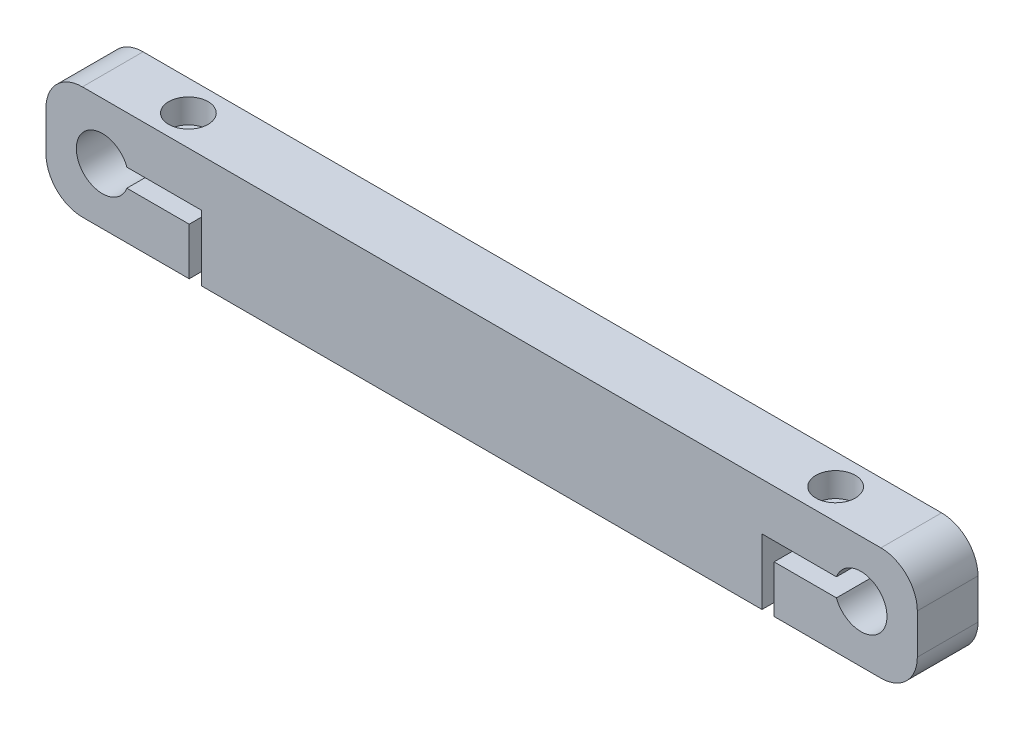
from build123d import *

# Parameters (mm, degrees)
SALIENTE_EXTRUIR1_DEPTH = 10
CROQUIS2_R              = 1.9
CORTAR_EXTRUIR1_DEPTH   = 25
CROQUIS5_R              = 3.25
CORTAR_EXTRUIR3_DEPTH   = 4
CORTAR_EXTRUIR4_DEPTH   = 4.25


with BuildPart() as part:
    # Croquis1 → Saliente-Extruir1 (new body)
    with BuildSketch(Plane.XY):
        with BuildLine():
            Line((65.8, 9.3), (-65.8, 9.3))
            ThreePointArc((-65.8, 9.3), (-70.042640687, 7.542640687), (-71.8, 3.3))
            Line((-71.8, 3.3), (-71.8, -3.3))
            ThreePointArc((-71.8, -3.3), (-70.042640687, -7.542640687), (-65.8, -9.3))
            Line((-65.8, -9.3), (-48.2, -9.3))
            Line((-48.2, -9.3), (-48.2, -1.5))
            Line((-48.2, -1.5), (-58.470111664, -1.5))
            ThreePointArc((-58.470111664, -1.5), (-66.8, 0), (-58.470111664, 1.5))
            Line((-58.470111664, 1.5), (-46.2, 1.5))
            Line((-46.2, 1.5), (-46.2, -9.3))
            Line((-46.2, -9.3), (46.2, -9.3))
            Line((46.2, -9.3), (46.2, 1.5))
            Line((46.2, 1.5), (58.470111664, 1.5))
            ThreePointArc((58.470111664, 1.5), (63.262063041, 4.231933355), (66.8, 0))
            ThreePointArc((66.8, 0), (63.262063041, -4.231933355), (58.470111664, -1.5))
            Line((58.470111664, -1.5), (48.2, -1.5))
            Line((48.2, -1.5), (48.2, -9.3))
            Line((48.2, -9.3), (65.8, -9.3))
            ThreePointArc((65.8, -9.3), (70.042640687, -7.542640687), (71.8, -3.3))
            Line((71.8, -3.3), (71.8, 3.3))
            ThreePointArc((71.8, 3.3), (70.042640687, 7.542640687), (65.8, 9.3))
        make_face()
    extrude(amount=SALIENTE_EXTRUIR1_DEPTH)

    # Croquis2 → Cortar-Extruir1 (cut, symmetric)
    with BuildSketch(Plane.XZ.offset(-1.5)):
        with Locations(Location((-53.335111664, 5, 0), (0, 0, 180))):
            Circle(CROQUIS2_R)
        with Locations(Location((53.335111664, 5, 0), (0, 0, 180))):
            Circle(CROQUIS2_R)
    extrude(amount=CORTAR_EXTRUIR1_DEPTH, both=True, mode=Mode.SUBTRACT)

    # Croquis5 → Cortar-Extruir3 (cut)
    with BuildSketch(Plane(origin=(0, 9.3, 0), x_dir=(1, 0, 0), z_dir=(0, 1, 0))):
        with Locations(Location((-53.335111664, -5, 0), (0, 0, 270))):
            Circle(CROQUIS5_R)
        with Locations(Location((53.335111664, -5, 0), (0, 0, 270))):
            Circle(CROQUIS5_R)
    extrude(amount=-CORTAR_EXTRUIR3_DEPTH, mode=Mode.SUBTRACT)

    # Croquis6 → Cortar-Extruir4 (cut)
    with BuildSketch(Plane(origin=(0, -9.3, 0), x_dir=(-1, 0, 0), z_dir=(0, -1, 0))):
        Polygon((49.871010049, -5), (51.603060857, -8), (55.067162472, -8), (56.799213279, -5), (55.067162472, -2), (51.603060857, -2), align=None)
        Polygon((-49.871010049, -5), (-51.603060857, -2), (-55.067162472, -2), (-56.799213279, -5), (-55.067162472, -8), (-51.603060857, -8), align=None)
    extrude(amount=-CORTAR_EXTRUIR4_DEPTH, mode=Mode.SUBTRACT)


solid = part.part
